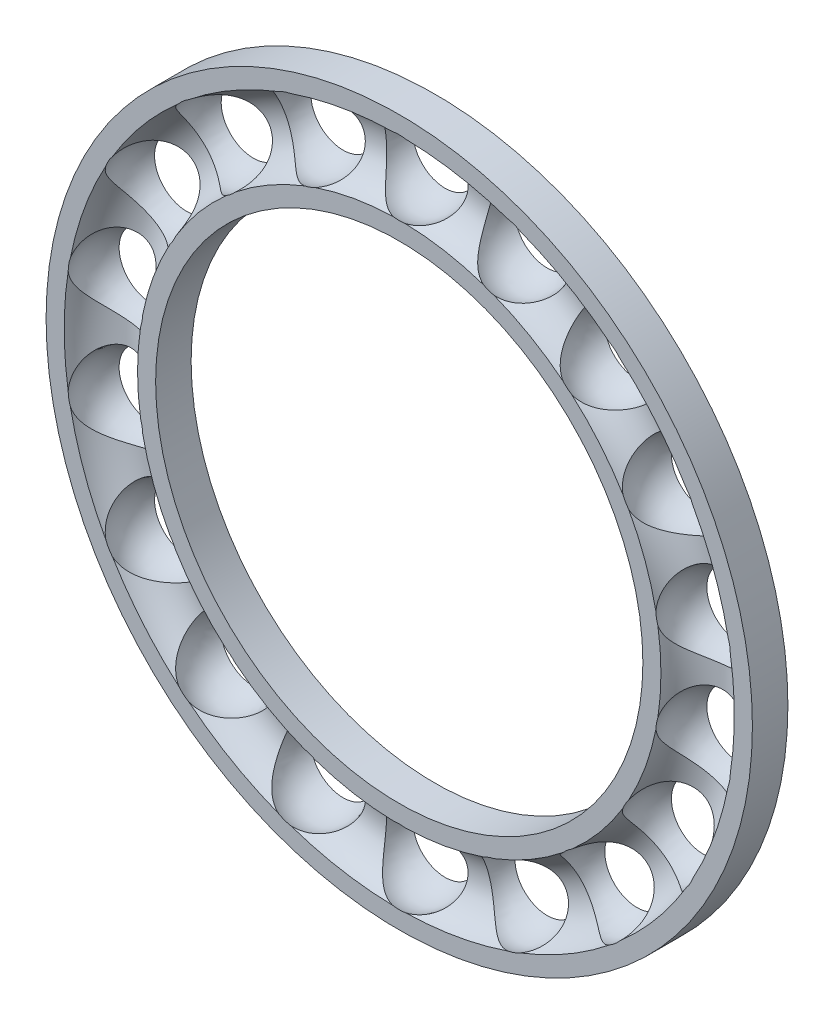
from build123d import *

# Parameters (mm, degrees)
ESQUISSE1_R                  = 23.375
ESQUISSE1_R_2                = 16.125
BOSS_EXTRU_1_DEPTH           = 3.54
R_P_TITION_CIRCULAIRE1_COUNT = 18
ESQUISSE4_R                  = 23.375
ESQUISSE4_R_2                = 2.630727575
ESQUISSE4_R_3                = 16.125
ENL_V_MAT_EXTRU_1_DEPTH      = 0.69
ESQUISSE5_R                  = 2.52
ENL_V_START                  = -0.5
ESQUISSE6_R                  = 23.375
ENL_V_MAT_EXTRU_2_DEPTH      = 0.5


with BuildPart() as part:
    # Esquisse1 → Boss.-Extru.1 (new body)
    with BuildSketch(Plane.XY):
        Circle(ESQUISSE1_R)
        Circle(ESQUISSE1_R_2, mode=Mode.SUBTRACT)
    extrude(amount=BOSS_EXTRU_1_DEPTH)

    # Esquisse3 → Enlèvement de matière-Révolution1 (revolve, cut)
    with BuildSketch(Plane.XY.offset(1.77)):
        with BuildLine():
            Line((0, 22.52), (0, 16.98))
            ThreePointArc((0, 16.98), (2.77, 19.75), (0, 22.52))
        make_face()
    enl_vement_de_mati_re_r_volution1 = revolve(axis=Axis((0, 16.125, 1.77), (0, 1, 0)), mode=Mode.SUBTRACT)

    # Répétition circulaire1: Enlèvement de matière-Révolution1 ×18 about axis
    r_p_tition_circulaire1_axis = Axis((0, 0, 0), (0, 0, 1))
    for i in range(1, R_P_TITION_CIRCULAIRE1_COUNT):
        add(enl_vement_de_mati_re_r_volution1.rotate(r_p_tition_circulaire1_axis, i * 360 / R_P_TITION_CIRCULAIRE1_COUNT), mode=Mode.SUBTRACT)

    # Esquisse4 → Enlèv. mat.-Extru.1 (cut)
    with BuildSketch(Plane(origin=(0, 0, 0), x_dir=(-1, 0, 0), z_dir=(0, 0, -1))):
        Circle(ESQUISSE4_R)
        with Locations((-6.754897831, 18.558929261)):
            Circle(ESQUISSE4_R_2, mode=Mode.SUBTRACT)
        with Locations((-12.695055291, 15.129377752)):
            Circle(ESQUISSE4_R_2, mode=Mode.SUBTRACT)
        with Locations((-17.104001725, 9.875)):
            Circle(ESQUISSE4_R_2, mode=Mode.SUBTRACT)
        with Locations((-19.449953122, 3.429551509)):
            Circle(ESQUISSE4_R_2, mode=Mode.SUBTRACT)
        with Locations((-19.449953122, -3.429551509)):
            Circle(ESQUISSE4_R_2, mode=Mode.SUBTRACT)
        with Locations((-17.104001725, -9.875)):
            Circle(ESQUISSE4_R_2, mode=Mode.SUBTRACT)
        with Locations((-12.695055291, -15.129377752)):
            Circle(ESQUISSE4_R_2, mode=Mode.SUBTRACT)
        with Locations((-6.754897831, -18.558929261)):
            Circle(ESQUISSE4_R_2, mode=Mode.SUBTRACT)
        with Locations((0, -19.75)):
            Circle(ESQUISSE4_R_2, mode=Mode.SUBTRACT)
        with Locations((6.754897831, -18.558929261)):
            Circle(ESQUISSE4_R_2, mode=Mode.SUBTRACT)
        with Locations((12.695055291, -15.129377752)):
            Circle(ESQUISSE4_R_2, mode=Mode.SUBTRACT)
        with Locations((17.104001725, -9.875)):
            Circle(ESQUISSE4_R_2, mode=Mode.SUBTRACT)
        with Locations((19.449953122, -3.429551509)):
            Circle(ESQUISSE4_R_2, mode=Mode.SUBTRACT)
        with Locations((19.449953122, 3.429551509)):
            Circle(ESQUISSE4_R_2, mode=Mode.SUBTRACT)
        with Locations((17.104001725, 9.875)):
            Circle(ESQUISSE4_R_2, mode=Mode.SUBTRACT)
        with Locations((12.695055291, 15.129377752)):
            Circle(ESQUISSE4_R_2, mode=Mode.SUBTRACT)
        with Locations((6.754897831, 18.558929261)):
            Circle(ESQUISSE4_R_2, mode=Mode.SUBTRACT)
        with Locations((0, 19.75)):
            Circle(ESQUISSE4_R_2, mode=Mode.SUBTRACT)
        Circle(ESQUISSE4_R_3, mode=Mode.SUBTRACT)
    extrude(amount=-ENL_V_MAT_EXTRU_1_DEPTH, mode=Mode.SUBTRACT)

    # Esquisse5 → Enlèvement de matière-Révolution2 (revolve, cut)
    with BuildSketch(Plane(origin=(0, 0, 0), x_dir=(1, 0, 0), z_dir=(0, 1, 0)), mode=Mode.PRIVATE) as enl_vement_de_mati_re_r_volution2_sk:
        with Locations((19.75, -3.71)):
            Circle(ESQUISSE5_R)
    revolve(enl_vement_de_mati_re_r_volution2_sk.sketch.rotate(Axis((0, 0, 0), (0, 0, -1)), 180), axis=Axis((0, 0, 0), (0, 0, -1)), mode=Mode.SUBTRACT)

    # Esquisse6 → Enlèv. mat.-Extru.2 (cut)
    with BuildSketch(Plane.XY.offset(3.54).offset(ENL_V_START)):
        with Locations(Location((0, 0, 0), (0, 0, 180))):
            Circle(ESQUISSE6_R)
    extrude(amount=ENL_V_MAT_EXTRU_2_DEPTH, mode=Mode.SUBTRACT)


solid = part.part
